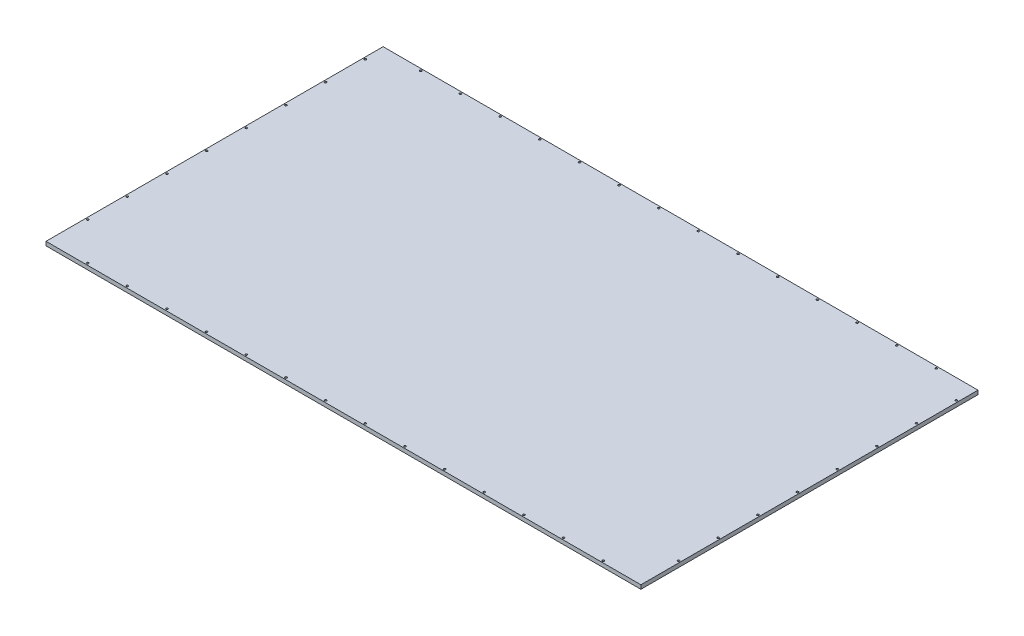
from build123d import *

# Parameters (mm, degrees)
CROQUIS1_W            = 1500
CROQUIS1_H            = 850
DAR_ESPESOR5_T1       = 10
CROQUIS8_R            = 2.5
CORTAR_EXTRUIR2_DEPTH = 5


with BuildPart() as body_1:
    # Croquis1 → Superficie-Plano4: a flat surface bounded by the sketch
    with BuildSketch(Plane(origin=(0, 0, 0), x_dir=(1, 0, 0), z_dir=(0, 1, 0)), mode=Mode.PRIVATE) as superficie_plano4_1_region:
        Rectangle(CROQUIS1_W, CROQUIS1_H)
    superficie_plano4_1 = superficie_plano4_1_region.sketch.faces()[0]
    add(Solid.thicken(superficie_plano4_1, DAR_ESPESOR5_T1))

    # Croquis8 → Cortar-Extruir2 (cut)
    with BuildSketch(Plane(origin=(0, 10, 0), x_dir=(1, 0, 0), z_dir=(0, 1, 0))):
        with Locations(Location((-650, 420, 0), (0, 0, 270))):
            Circle(CROQUIS8_R)
        with Locations(Location((-550, 420, 0), (0, 0, 270))):
            Circle(CROQUIS8_R)
        with Locations(Location((-450, 420, 0), (0, 0, 270))):
            Circle(CROQUIS8_R)
        with Locations(Location((-350, 420, 0), (0, 0, 270))):
            Circle(CROQUIS8_R)
        with Locations(Location((-250, 420, 0), (0, 0, 270))):
            Circle(CROQUIS8_R)
        with Locations(Location((-150, 420, 0), (0, 0, 270))):
            Circle(CROQUIS8_R)
        with Locations(Location((-50, 420, 0), (0, 0, 270))):
            Circle(CROQUIS8_R)
        with Locations(Location((50, 420, 0), (0, 0, 270))):
            Circle(CROQUIS8_R)
        with Locations(Location((150, 420, 0), (0, 0, 270))):
            Circle(CROQUIS8_R)
        with Locations(Location((250, 420, 0), (0, 0, 270))):
            Circle(CROQUIS8_R)
        with Locations(Location((350, 420, 0), (0, 0, 270))):
            Circle(CROQUIS8_R)
        with Locations(Location((450, 420, 0), (0, 0, 270))):
            Circle(CROQUIS8_R)
        with Locations(Location((550, 420, 0), (0, 0, 270))):
            Circle(CROQUIS8_R)
        with Locations(Location((650, 420, 0), (0, 0, 270))):
            Circle(CROQUIS8_R)
        with Locations(Location((650, -420, 0), (0, 0, 90))):
            Circle(CROQUIS8_R)
        with Locations(Location((550, -420, 0), (0, 0, 90))):
            Circle(CROQUIS8_R)
        with Locations(Location((450, -420, 0), (0, 0, 90))):
            Circle(CROQUIS8_R)
        with Locations(Location((350, -420, 0), (0, 0, 90))):
            Circle(CROQUIS8_R)
        with Locations(Location((250, -420, 0), (0, 0, 90))):
            Circle(CROQUIS8_R)
        with Locations(Location((150, -420, 0), (0, 0, 90))):
            Circle(CROQUIS8_R)
        with Locations(Location((50, -420, 0), (0, 0, 90))):
            Circle(CROQUIS8_R)
        with Locations(Location((-50, -420, 0), (0, 0, 90))):
            Circle(CROQUIS8_R)
        with Locations(Location((-150, -420, 0), (0, 0, 90))):
            Circle(CROQUIS8_R)
        with Locations(Location((-250, -420, 0), (0, 0, 90))):
            Circle(CROQUIS8_R)
        with Locations(Location((-350, -420, 0), (0, 0, 90))):
            Circle(CROQUIS8_R)
        with Locations(Location((-450, -420, 0), (0, 0, 90))):
            Circle(CROQUIS8_R)
        with Locations(Location((-550, -420, 0), (0, 0, 90))):
            Circle(CROQUIS8_R)
        with Locations(Location((-650, -420, 0), (0, 0, 90))):
            Circle(CROQUIS8_R)
        with Locations(Location((-745, -325, 0), (0, 0, 270))):
            Circle(CROQUIS8_R)
        with Locations(Location((-745, -225, 0), (0, 0, 270))):
            Circle(CROQUIS8_R)
        with Locations(Location((-745, -125, 0), (0, 0, 270))):
            Circle(CROQUIS8_R)
        with Locations(Location((-745, -25, 0), (0, 0, 270))):
            Circle(CROQUIS8_R)
        with Locations(Location((-745, 75, 0), (0, 0, 270))):
            Circle(CROQUIS8_R)
        with Locations(Location((-745, 175, 0), (0, 0, 270))):
            Circle(CROQUIS8_R)
        with Locations(Location((-745, 275, 0), (0, 0, 270))):
            Circle(CROQUIS8_R)
        with Locations(Location((-745, 375, 0), (0, 0, 270))):
            Circle(CROQUIS8_R)
        with Locations(Location((745, -325, 0), (0, 0, 90))):
            Circle(CROQUIS8_R)
        with Locations(Location((745, -225, 0), (0, 0, 90))):
            Circle(CROQUIS8_R)
        with Locations(Location((745, -125, 0), (0, 0, 90))):
            Circle(CROQUIS8_R)
        with Locations(Location((745, -25, 0), (0, 0, 90))):
            Circle(CROQUIS8_R)
        with Locations(Location((745, 75, 0), (0, 0, 90))):
            Circle(CROQUIS8_R)
        with Locations(Location((745, 175, 0), (0, 0, 90))):
            Circle(CROQUIS8_R)
        with Locations(Location((745, 275, 0), (0, 0, 90))):
            Circle(CROQUIS8_R)
        with Locations(Location((745, 375, 0), (0, 0, 90))):
            Circle(CROQUIS8_R)
    extrude(amount=-CORTAR_EXTRUIR2_DEPTH, mode=Mode.SUBTRACT)


solid = body_1.part
